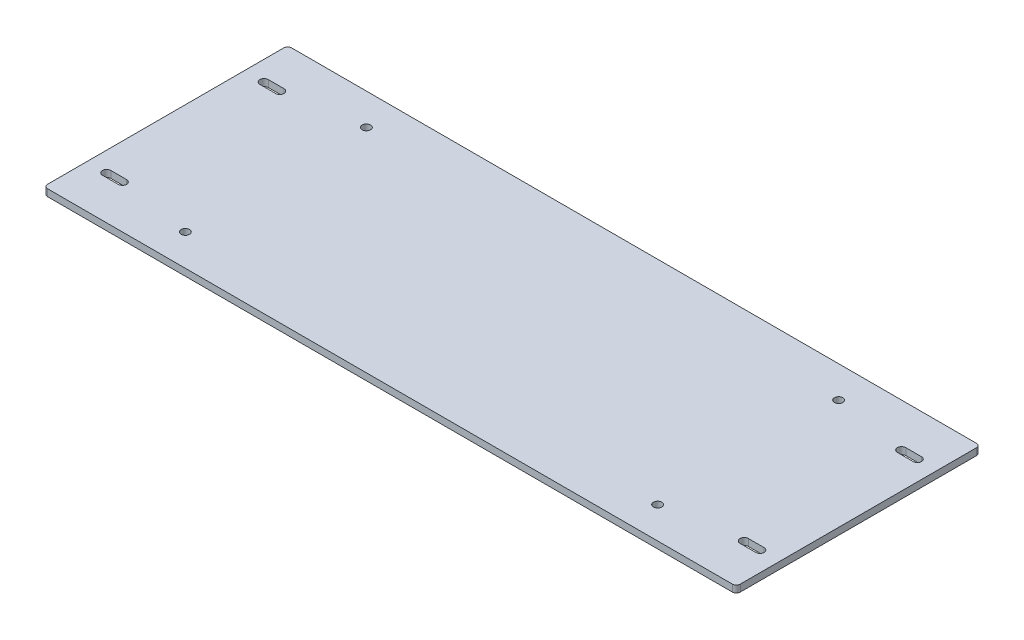
from build123d import *

# Parameters (mm, degrees)
SKETCH1_W           = 558.8
SKETCH1_H           = 196.85
BOSS_EXTRUDE1_DEPTH = 5.588
FILLET1_R           = 3.175
SKETCH2_R           = 3.3782
CUT_EXTRUDE1_DEPTH  = 593.485095377


with BuildPart() as part:
    # Sketch1 → Boss-Extrude1 (new body)
    with BuildSketch(Plane(origin=(0, 0, 0), x_dir=(1, 0, 0), z_dir=(0, 1, 0))):
        with Locations((279.4, 98.425)):
            Rectangle(SKETCH1_W, SKETCH1_H)
        with BuildLine():
            Line((15.875, 38.3032), (28.575, 38.3032))
            ThreePointArc((28.575, 38.3032), (31.9532, 34.925), (28.575, 31.5468))
            Line((28.575, 31.5468), (15.875, 31.5468))
            ThreePointArc((15.875, 31.5468), (12.4968, 34.925), (15.875, 38.3032))
        make_face(mode=Mode.SUBTRACT)
        with BuildLine():
            Line((15.875, 165.3032), (28.575, 165.3032))
            ThreePointArc((28.575, 165.3032), (31.9532, 161.925), (28.575, 158.5468))
            Line((28.575, 158.5468), (15.875, 158.5468))
            ThreePointArc((15.875, 158.5468), (12.4968, 161.925), (15.875, 165.3032))
        make_face(mode=Mode.SUBTRACT)
        with BuildLine():
            Line((542.925, 158.5468), (530.225, 158.5468))
            ThreePointArc((530.225, 158.5468), (526.8468, 161.925), (530.225, 165.3032))
            Line((530.225, 165.3032), (542.925, 165.3032))
            ThreePointArc((542.925, 165.3032), (546.3032, 161.925), (542.925, 158.5468))
        make_face(mode=Mode.SUBTRACT)
        with BuildLine():
            Line((542.925, 31.5468), (530.225, 31.5468))
            ThreePointArc((530.225, 31.5468), (526.8468, 34.925), (530.225, 38.3032))
            Line((530.225, 38.3032), (542.925, 38.3032))
            ThreePointArc((542.925, 38.3032), (546.3032, 34.925), (542.925, 31.5468))
        make_face(mode=Mode.SUBTRACT)
    extrude(amount=BOSS_EXTRUDE1_DEPTH)

    # Fillet1
    fillet1_edges = [part.edges().sort_by_distance(p)[0] for p in [
        (0, 2.794, -196.85),
        (558.8, 2.794, -196.85),
        (558.8, 2.794, 0),
        (0, 2.794, 0),
    ]]
    fillet(fillet1_edges, radius=FILLET1_R)

    # Sketch2 → Cut-Extrude1 (cut, through all)
    with BuildSketch(Plane(origin=(0, 5.588, 0), x_dir=(1, 0, 0), z_dir=(0, 1, 0))):
        with Locations(Location((88.9, 171.45, 0), (0, 0, 270))):
            Circle(SKETCH2_R)
        with Locations(Location((88.9, 25.4, 0), (0, 0, 270))):
            Circle(SKETCH2_R)
        with Locations(Location((469.9, 25.4, 0), (0, 0, 270))):
            Circle(SKETCH2_R)
        with Locations(Location((469.9, 171.45, 0), (0, 0, 270))):
            Circle(SKETCH2_R)
    extrude(amount=-CUT_EXTRUDE1_DEPTH, mode=Mode.SUBTRACT)


solid = part.part
